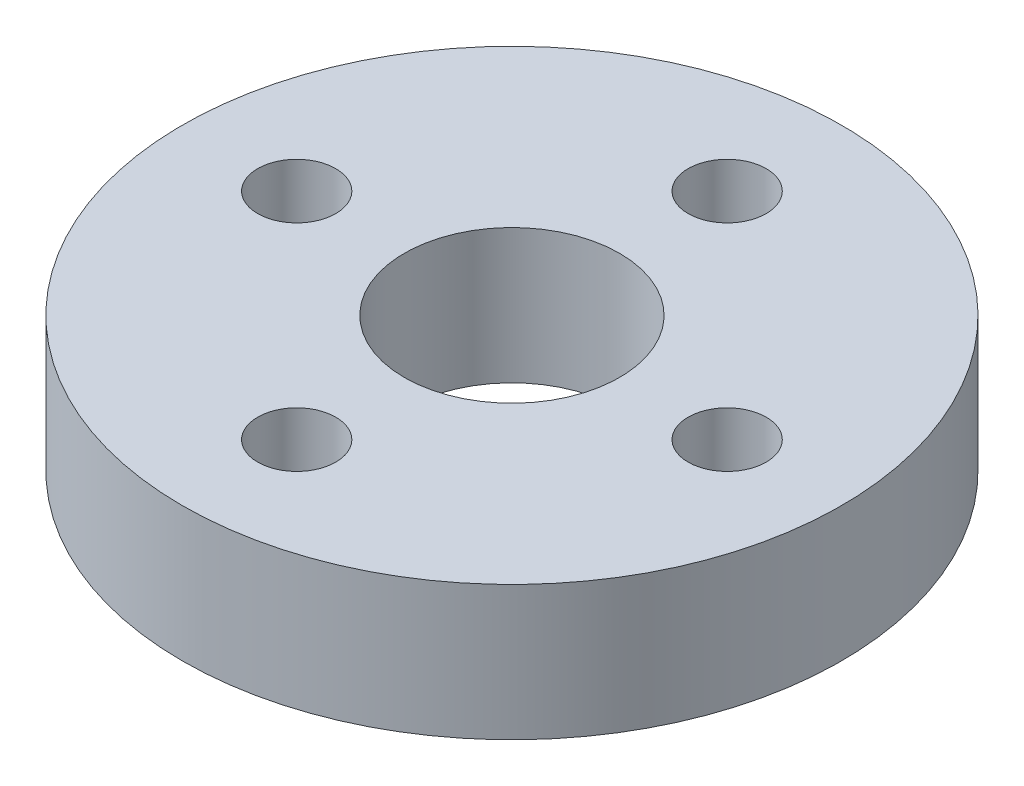
from build123d import *

# Parameters (mm, degrees)
SKETCH_1_R      = 12.25
SKETCH_1_R_2    = 4
SKETCH_1_R_3    = 1.45
EXTRUDE_1_DEPTH = 5


with BuildPart() as part:
    # 草图1 → 凸台-拉伸1 (new body)
    with BuildSketch(Plane(origin=(0, 0, 0), x_dir=(1, 0, 0), z_dir=(0, 1, 0))):
        with Locations(Location((0, 0, 0), (0, 0, 270))):
            Circle(SKETCH_1_R)
        with Locations(Location((0, 0, 0), (0, 0, 270))):
            Circle(SKETCH_1_R_2, mode=Mode.SUBTRACT)
        with Locations(Location((0, 8, 0), (0, 0, 270))):
            Circle(SKETCH_1_R_3, mode=Mode.SUBTRACT)
        with Locations(Location((8, 0, 0), (0, 0, 270))):
            Circle(SKETCH_1_R_3, mode=Mode.SUBTRACT)
        with Locations(Location((0, -8, 0), (0, 0, 270))):
            Circle(SKETCH_1_R_3, mode=Mode.SUBTRACT)
        with Locations(Location((-8, 0, 0), (0, 0, 270))):
            Circle(SKETCH_1_R_3, mode=Mode.SUBTRACT)
    extrude(amount=EXTRUDE_1_DEPTH)


solid = part.part
